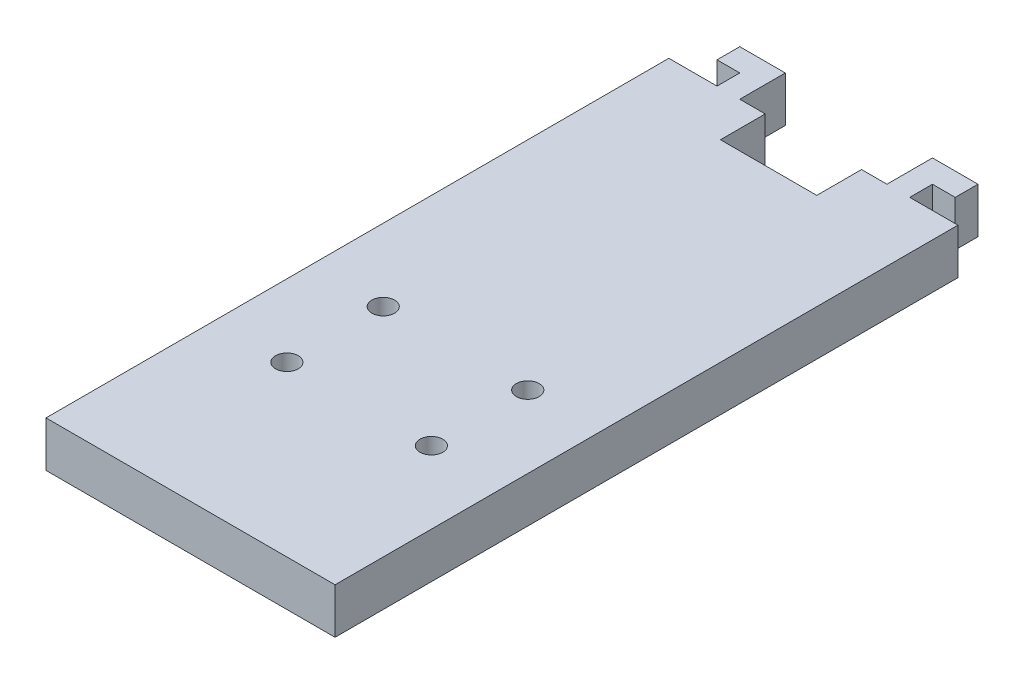
from build123d import *

# Parameters (mm, degrees)
BOSS_EXTRUDE1_DEPTH     = 2.999999969
CUT_EXTRUDE1_DEPTH      = 54.841456961
CUT_EXTRUDE1_DEPTH_BACK = 54.841456961
SKETCH2_R               = 1.5


with BuildPart() as part:
    # Sketch1 → Boss-Extrude1 (new, symmetric)
    with BuildSketch(Plane(origin=(0, 0, 0), x_dir=(1, 0, 0), z_dir=(0, 1, 0))):
        Polygon((15.7, 43.999999884), (12.7, 43.999999884), (9.7, 43.999999884), (6.35, 43.999999884), (6.35, 38.1), (-6.35, 38.1), (-6.35, 43.999999884), (-9.7, 43.999999884), (-12.7, 43.999999884), (-15.7, 43.999999884), (-19.05, 43.999999884), (-19.05, 38.1), (-19.05, -38.1), (19.05, -38.1), (19.05, 38.1), (19.05, 43.999999884), align=None)
        Polygon((-12.7, 43.999999884), (-9.7, 43.999999884), (-9.7, 49.999999884), (-15.7, 49.999999884), (-15.7, 46.999999884), (-12.7, 46.999999884), align=None)
        Polygon((9.7, 43.999999884), (12.7, 43.999999884), (12.7, 46.999999884), (15.7, 46.999999884), (15.7, 49.999999884), (9.7, 49.999999884), align=None)
    extrude(amount=BOSS_EXTRUDE1_DEPTH, both=True)

    # Sketch2 → Cut-Extrude1 (cut, two sides: drawn at the far end of the back side and taken through both)
    with BuildSketch(Plane(origin=(0, 2.999999969, 0), x_dir=(1, 0, 0), z_dir=(0, 1, 0)).offset(-CUT_EXTRUDE1_DEPTH_BACK)):
        with Locations(Location((-9.525, -3.175, 0), (0, 0, 270))):
            Circle(SKETCH2_R)
        with Locations(Location((9.525, -3.175, 0), (0, 0, 270))):
            Circle(SKETCH2_R)
        with Locations(Location((9.525, -15.875, 0), (0, 0, 270))):
            Circle(SKETCH2_R)
        with Locations(Location((-9.525, -15.875, 0), (0, 0, 270))):
            Circle(SKETCH2_R)
    extrude(amount=CUT_EXTRUDE1_DEPTH + CUT_EXTRUDE1_DEPTH_BACK, mode=Mode.SUBTRACT)


solid = part.part
